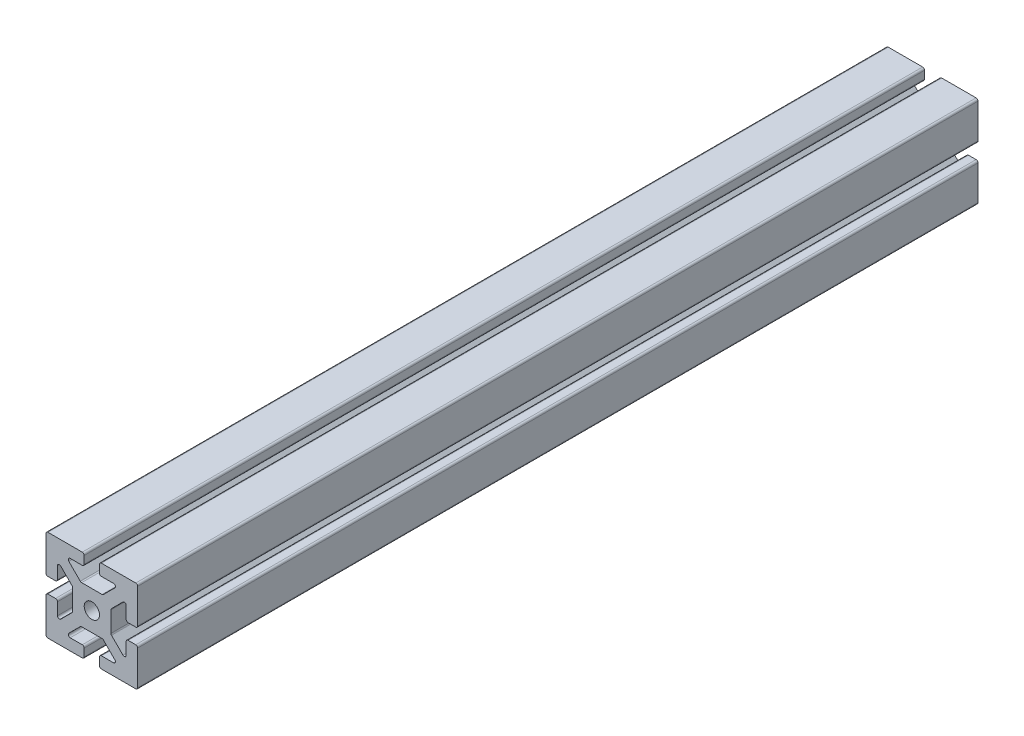
from build123d import *

# Parameters (mm, degrees)
SKETCH1_R           = 1
BOSS_EXTRUDE1_DEPTH = 110


with BuildPart() as part:
    # Sketch1 → Boss-Extrude1 (new body)
    with BuildSketch(Plane.XY):
        with BuildLine():
            Line((-1.335786438, 2.5), (1.335786438, 2.5))
            ThreePointArc((1.335786438, 2.5), (1.431457296, 2.519030117), (1.512563133, 2.573223305))
            Line((1.512563133, 2.573223305), (3.012563133, 4.073223305))
            ThreePointArc((3.012563133, 4.073223305), (3.066756321, 4.345670858), (2.835786438, 4.5))
            Line((2.835786438, 4.5), (1.25, 4.5))
            ThreePointArc((1.25, 4.5), (1.073223305, 4.573223305), (1, 4.75))
            Line((1, 4.75), (1, 5.75))
            ThreePointArc((1, 5.75), (1.073223305, 5.926776695), (1.25, 6))
            Line((1.25, 6), (5.75, 6))
            ThreePointArc((5.75, 6), (5.926776695, 5.926776695), (6, 5.75))
            Line((6, 5.75), (6, 1.25))
            ThreePointArc((6, 1.25), (5.926776695, 1.073223305), (5.75, 1))
            Line((5.75, 1), (4.75, 1))
            ThreePointArc((4.75, 1), (4.573223305, 1.073223305), (4.5, 1.25))
            Line((4.5, 1.25), (4.5, 2.835786438))
            ThreePointArc((4.5, 2.835786438), (4.345670858, 3.066756321), (4.073223305, 3.012563133))
            Line((4.073223305, 3.012563133), (2.573223305, 1.512563133))
            ThreePointArc((2.573223305, 1.512563133), (2.519030117, 1.431457296), (2.5, 1.335786438))
            Line((2.5, 1.335786438), (2.5, -1.335786438))
            ThreePointArc((2.5, -1.335786438), (2.519030117, -1.431457296), (2.573223305, -1.512563133))
            Line((2.573223305, -1.512563133), (4.073223305, -3.012563133))
            ThreePointArc((4.073223305, -3.012563133), (4.345670858, -3.066756321), (4.5, -2.835786438))
            Line((4.5, -2.835786438), (4.5, -1.25))
            ThreePointArc((4.5, -1.25), (4.573223305, -1.073223305), (4.75, -1))
            Line((4.75, -1), (5.75, -1))
            ThreePointArc((5.75, -1), (5.926776695, -1.073223305), (6, -1.25))
            Line((6, -1.25), (6, -5.75))
            ThreePointArc((6, -5.75), (5.926776695, -5.926776695), (5.75, -6))
            Line((5.75, -6), (1.25, -6))
            ThreePointArc((1.25, -6), (1.073223305, -5.926776695), (1, -5.75))
            Line((1, -5.75), (1, -4.75))
            ThreePointArc((1, -4.75), (1.073223305, -4.573223305), (1.25, -4.5))
            Line((1.25, -4.5), (2.835786438, -4.5))
            ThreePointArc((2.835786438, -4.5), (3.066756321, -4.345670858), (3.012563133, -4.073223305))
            Line((3.012563133, -4.073223305), (1.512563133, -2.573223305))
            ThreePointArc((1.512563133, -2.573223305), (1.431457296, -2.519030117), (1.335786438, -2.5))
            Line((1.335786438, -2.5), (-1.335786438, -2.5))
            ThreePointArc((-1.335786438, -2.5), (-1.431457296, -2.519030117), (-1.512563133, -2.573223305))
            Line((-1.512563133, -2.573223305), (-3.012563133, -4.073223305))
            ThreePointArc((-3.012563133, -4.073223305), (-3.066756321, -4.345670858), (-2.835786438, -4.5))
            Line((-2.835786438, -4.5), (-1.25, -4.5))
            ThreePointArc((-1.25, -4.5), (-1.073223305, -4.573223305), (-1, -4.75))
            Line((-1, -4.75), (-1, -5.75))
            ThreePointArc((-1, -5.75), (-1.073223305, -5.926776695), (-1.25, -6))
            Line((-1.25, -6), (-5.75, -6))
            ThreePointArc((-5.75, -6), (-5.926776695, -5.926776695), (-6, -5.75))
            Line((-6, -5.75), (-6, -1.25))
            ThreePointArc((-6, -1.25), (-5.926776695, -1.073223305), (-5.75, -1))
            Line((-5.75, -1), (-4.75, -1))
            ThreePointArc((-4.75, -1), (-4.573223305, -1.073223305), (-4.5, -1.25))
            Line((-4.5, -1.25), (-4.5, -2.835786438))
            ThreePointArc((-4.5, -2.835786438), (-4.345670858, -3.066756321), (-4.073223305, -3.012563133))
            Line((-4.073223305, -3.012563133), (-2.573223305, -1.512563133))
            ThreePointArc((-2.573223305, -1.512563133), (-2.519030117, -1.431457296), (-2.5, -1.335786438))
            Line((-2.5, -1.335786438), (-2.5, 1.335786438))
            ThreePointArc((-2.5, 1.335786438), (-2.519030117, 1.431457296), (-2.573223305, 1.512563133))
            Line((-2.573223305, 1.512563133), (-4.073223305, 3.012563133))
            ThreePointArc((-4.073223305, 3.012563133), (-4.345670858, 3.066756321), (-4.5, 2.835786438))
            Line((-4.5, 2.835786438), (-4.5, 1.25))
            ThreePointArc((-4.5, 1.25), (-4.573223305, 1.073223305), (-4.75, 1))
            Line((-4.75, 1), (-5.75, 1))
            ThreePointArc((-5.75, 1), (-5.926776695, 1.073223305), (-6, 1.25))
            Line((-6, 1.25), (-6, 5.75))
            ThreePointArc((-6, 5.75), (-5.926776695, 5.926776695), (-5.75, 6))
            Line((-5.75, 6), (-1.25, 6))
            ThreePointArc((-1.25, 6), (-1.073223305, 5.926776695), (-1, 5.75))
            Line((-1, 5.75), (-1, 4.75))
            ThreePointArc((-1, 4.75), (-1.073223305, 4.573223305), (-1.25, 4.5))
            Line((-1.25, 4.5), (-2.835786438, 4.5))
            ThreePointArc((-2.835786438, 4.5), (-3.066756321, 4.345670858), (-3.012563133, 4.073223305))
            Line((-3.012563133, 4.073223305), (-1.512563133, 2.573223305))
            ThreePointArc((-1.512563133, 2.573223305), (-1.431457296, 2.519030117), (-1.335786438, 2.5))
        make_face()
        Circle(SKETCH1_R, mode=Mode.SUBTRACT)
    extrude(amount=-BOSS_EXTRUDE1_DEPTH)


solid = part.part
